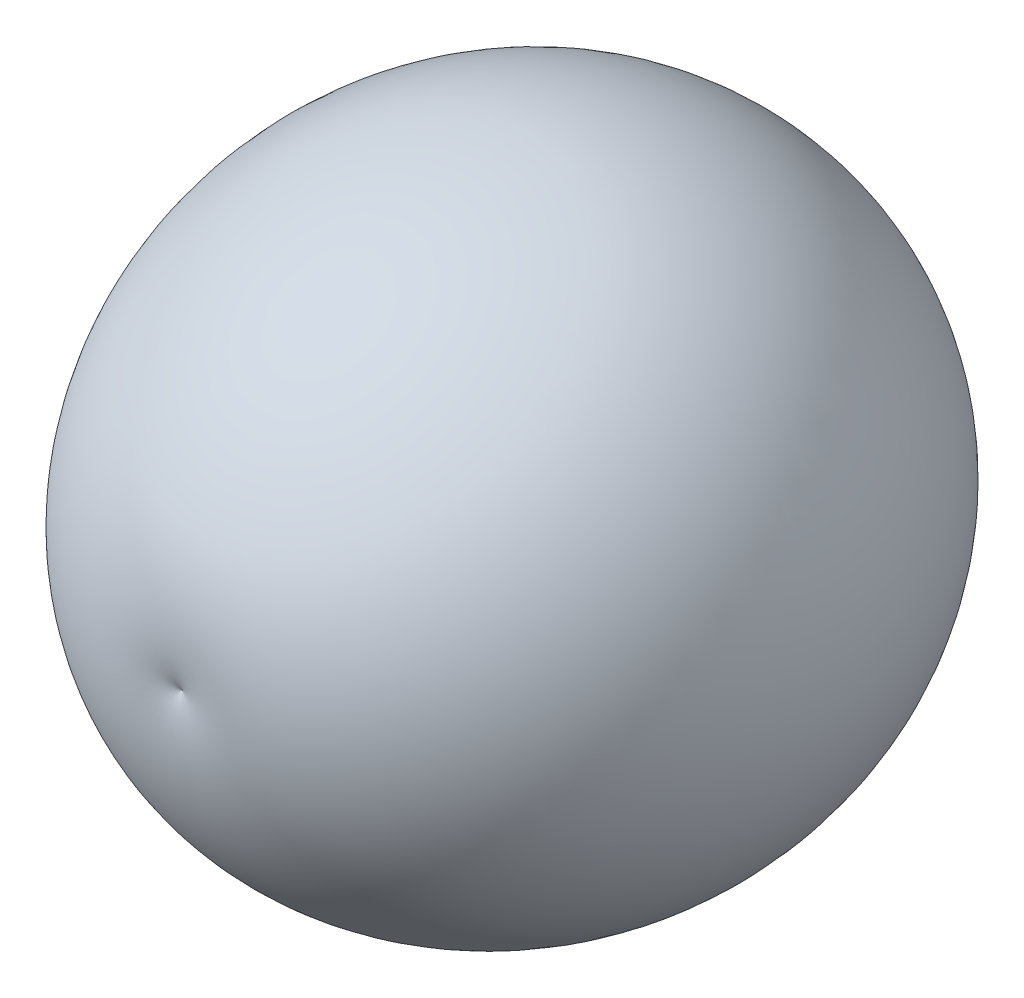
from build123d import *


with BuildPart() as part:
    # Sketch1 → Revolve2 (revolve)
    with BuildSketch(Plane(origin=(0, 0, 0), x_dir=(1, 0, 0), z_dir=(0, 1, 0))):
        with BuildLine():
            Line((0, 0), (0, 296.987166947))
            add(Edge.make_bspline(
                [(0, 0), (0.047986321, -0.032170326), (0.145134862, -0.094641733), (0.344202178, -0.212012113), (0.649410607, -0.376321721), (1.011788273, -0.555730005), (1.432424849, -0.747093767), (1.858031088, -0.92703884), (2.39525808, -1.139207801), (3.057789488, -1.379373609), (3.848387356, -1.638024585), (5.002155485, -1.973264111), (6.415439209, -2.322766938), (8.08061631, -2.658122802), (10.071569769, -2.965380962), (12.146773136, -3.195211102), (14.302793247, -3.345727051), (16.536298172, -3.414725171), (19.707943204, -3.398574226), (23.064818567, -3.205323054), (26.595576735, -2.822866935), (30.289045357, -2.237434117), (33.22552395, -1.665951987), (36.870242359, -0.829296861), (41.19793215, 0.360314403), (46.171806746, 2.000562742), (53.20029129, 4.766691595), (64.066271865, 9.974588959), (78.087998646, 18.824769896), (94.078039745, 32.602710922), (109.522130393, 51.006017186), (121.993292051, 71.530509103), (130.158145085, 90.889699436), (135.107715283, 108.176937845), (138.376785104, 125.838291985), (139.680812788, 140.766425165), (139.53990218, 155.7515861), (137.941693762, 170.634378491), (135.786987086, 182.413843164), (132.757744462, 193.999573999), (128.85963927, 205.322900291), (124.102852165, 216.313556295), (118.502761106, 226.899854399), (112.080527475, 237.009041725), (104.863770349, 246.567787483), (96.887156219, 255.502869604), (88.192954371, 263.742039758), (80.001639085, 270.280947105), (72.600050803, 275.365034326), (66.199296932, 279.235172874), (60.947906879, 282.103901173), (55.575062621, 284.738225891), (50.090627209, 287.131575809), (44.504824299, 289.277874601), (38.828450491, 291.171584885), (33.072441437, 292.807749889), (27.248504828, 294.18203213), (22.102972639, 295.152158828), (18.035094237, 295.760536135), (15.0656908, 296.124160412), (13.207831147, 296.323196206), (11.717044528, 296.465459961), (10.230783106, 296.590734539), (8.732303504, 296.698998444), (7.218505834, 296.792207093), (5.643172924, 296.869094234), (4.07854022, 296.928362498), (2.614122622, 296.963644046), (1.463102814, 296.981286093), (0.559088916, 296.986326825), (0.184648694, 296.987166947), (0, 296.987166947)],
                knots=[0, 0, 0, 0, 0, 0.000458674, 0.000917348, 0.001834697, 0.002752045, 0.003669393, 0.004586741, 0.00550409, 0.007338786, 0.009265156, 0.011191527, 0.015044267, 0.018897007, 0.022749747, 0.0271853, 0.031620852, 0.036056404, 0.040491956, 0.052368659, 0.05830701, 0.064245361, 0.070183878, 0.076122395, 0.087999428, 0.09987621, 0.111752993, 0.136078928, 0.183585528, 0.231092168, 0.278599013, 0.326105736, 0.37361243, 0.397365826, 0.421119223, 0.468625938, 0.492379295, 0.516132653, 0.53988602, 0.563639387, 0.587392748, 0.61114611, 0.634899475, 0.658652841, 0.682406204, 0.706159566, 0.729912927, 0.753666288, 0.765542968, 0.777419649, 0.78929633, 0.801173011, 0.81304969, 0.824926369, 0.836803048, 0.848679727, 0.860556405, 0.872433083, 0.878371422, 0.881340592, 0.884309761, 0.887278931, 0.8902481, 0.89321727, 0.896186439, 0.899412569, 0.902638698, 0.905864828, 0.907477892, 0.909090957, 0.909090957, 0.909090957, 0.909090957, 0.909090957], degree=4))
        make_face()
    revolve(axis=Axis((0, 0, -296.987166947), (0, 0, 1)))


solid = part.part
